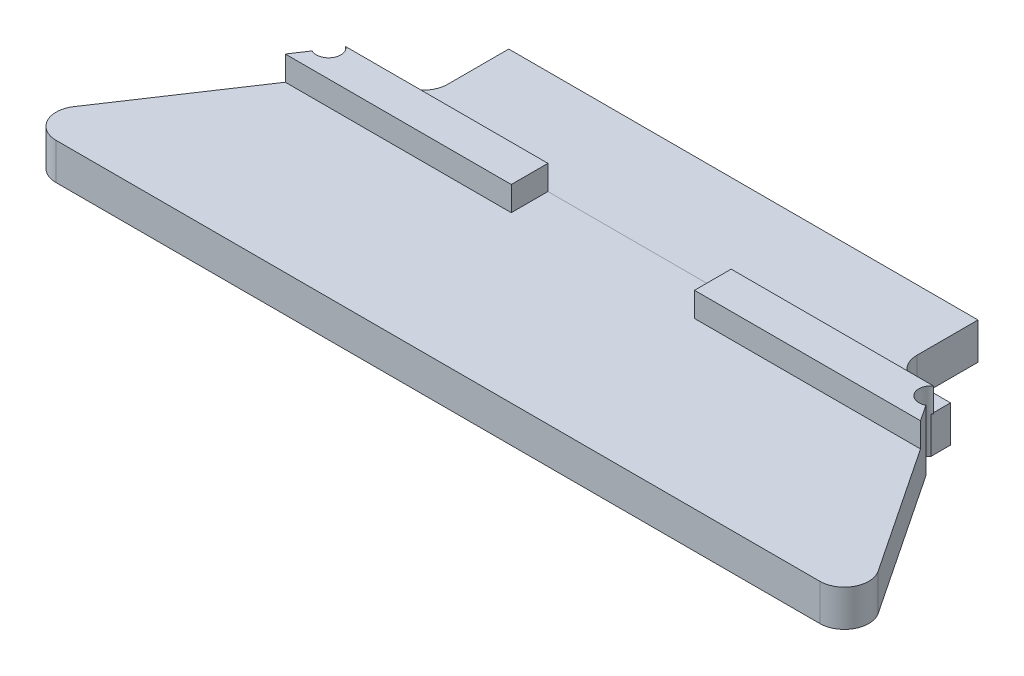
from build123d import *

# Parameters (mm, degrees)
BOSS_EXTRUDE1_DEPTH     = 1.5
CUT_EXTRUDE4_DEPTH      = 38.286056375
CUT_EXTRUDE4_DEPTH_BACK = 38.286056375
SKETCH4_W               = 0.25
SKETCH4_H               = 3
CUT_EXTRUDE5_DEPTH      = 38.286056375
CUT_EXTRUDE5_DEPTH_BACK = 38.286056375
SKETCH5_R               = 1
FILLET5_R               = 2
BOSS_EXTRUDE2_START     = 2
BOSS_EXTRUDE2_DEPTH     = 2


with BuildPart() as part:
    # Sketch1 → Boss-Extrude1 (new, symmetric)
    with BuildSketch(Plane(origin=(0, 0, 0), x_dir=(1, 0, 0), z_dir=(0, 1, 0))):
        Polygon((-25, -12.5), (25, -12.5), (35, -12.5), (25, 2.5), (24.20625, 2.5), (24.20625, 5.5), (19.20625, 5.5), (19.20625, 12.5), (-19.20625, 12.5), (-19.20625, 5.5), (-24.20625, 5.5), (-24.20625, 2.5), (-25, 2.5), (-35, -12.5), align=None)
    extrude(amount=BOSS_EXTRUDE1_DEPTH, both=True)

    # Sketch4 → Cut-Extrude4 (cut, two sides: drawn at the far end of the back side and taken through both)
    with BuildSketch(Plane(origin=(0, 1.5, 0), x_dir=(1, 0, 0), z_dir=(0, 1, 0)).offset(-CUT_EXTRUDE4_DEPTH_BACK)):
        with Locations((24.08125, 4)):
            Rectangle(SKETCH4_W, SKETCH4_H)
        with Locations((-24.08125, 4)):
            Rectangle(SKETCH4_W, SKETCH4_H)
    extrude(amount=CUT_EXTRUDE4_DEPTH + CUT_EXTRUDE4_DEPTH_BACK, mode=Mode.SUBTRACT)

    # Sketch5 → Cut-Extrude5 (cut, two sides: drawn at the far end of the back side and taken through both)
    with BuildSketch(Plane(origin=(0, 1.5, 0), x_dir=(1, 0, 0), z_dir=(0, 1, 0)).offset(-CUT_EXTRUDE5_DEPTH_BACK)):
        with Locations((-24.663356781, 3.207106781)):
            Circle(SKETCH5_R)
        with Locations((24.663356781, 3.207106781)):
            Circle(SKETCH5_R)
    extrude(amount=CUT_EXTRUDE5_DEPTH + CUT_EXTRUDE5_DEPTH_BACK, mode=Mode.SUBTRACT)

    # Fillet5
    fillet5_edges = [part.edges().sort_by_distance(p)[0] for p in [
        (-35, 0, 12.5),
        (-19.20625, 0, -5.5),
        (19.20625, 0, -5.5),
        (35, 0, 12.5),
    ]]
    fillet(fillet5_edges, radius=FILLET5_R)

    # Sketch6 → Boss-Extrude2 (add)
    with BuildSketch(Plane(origin=(0, 1.5, 0), x_dir=(1, 0, 0), z_dir=(0, 1, 0)).offset(BOSS_EXTRUDE2_START)):
        with BuildLine():
            Line((-24.053996179, 4), (-7.5, 4))
            Line((-7.5, 4), (-7.5, 1))
            Line((-7.5, 1), (-26, 1))
            Line((-26, 1), (-25.121262614, 2.318106079))
            ThreePointArc((-25.121262614, 2.318106079), (-23.819007075, 2.671314309), (-24.053996179, 4))
        make_face()
        with BuildLine():
            Line((26, 1), (25.121262614, 2.318106079))
            ThreePointArc((25.121262614, 2.318106079), (23.819007075, 2.671314309), (24.053996179, 4))
            Line((24.053996179, 4), (7.5, 4))
            Line((7.5, 4), (7.5, 1))
            Line((7.5, 1), (26, 1))
        make_face()
    extrude(amount=-BOSS_EXTRUDE2_DEPTH)


solid = part.part
